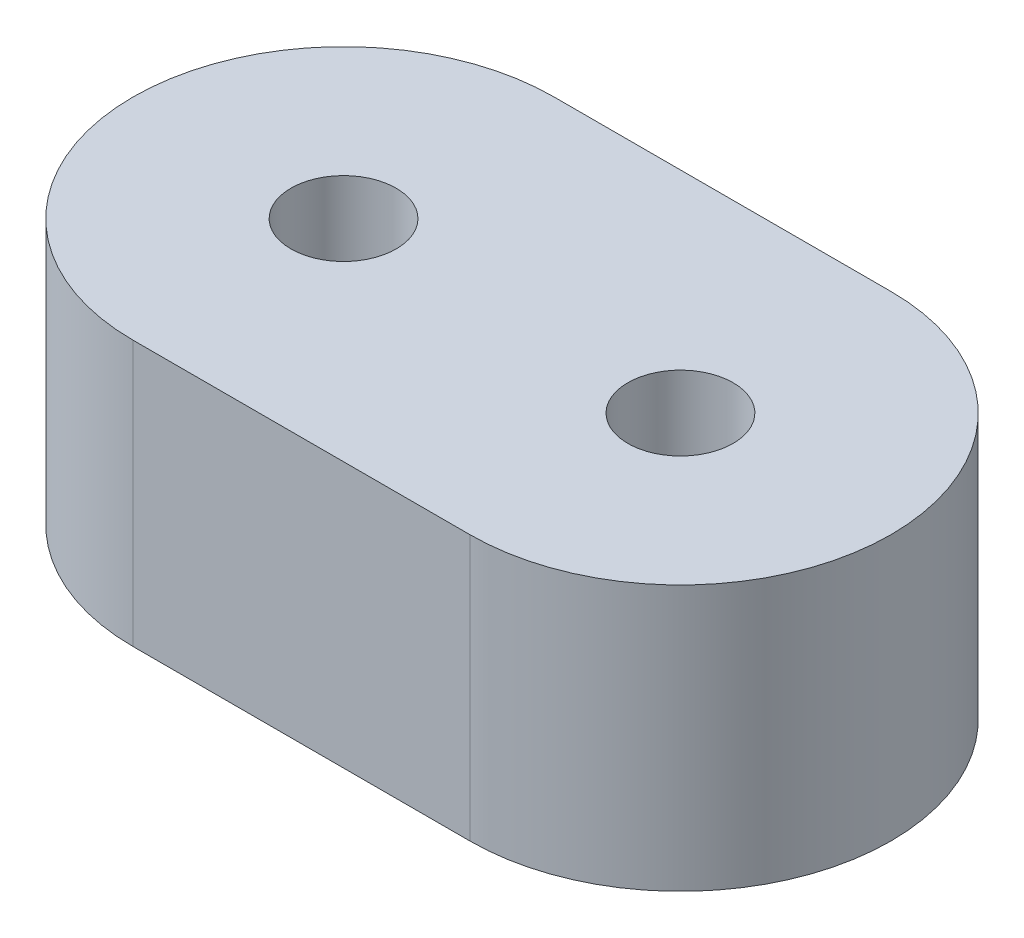
from build123d import *

# Parameters (mm, degrees)
SKETCH1_R           = 1.25
BOSS_EXTRUDE1_DEPTH = 6.3


with BuildPart() as part:
    # Sketch1 → Boss-Extrude1 (new body)
    with BuildSketch(Plane(origin=(0, 0, 0), x_dir=(1, 0, 0), z_dir=(0, 1, 0))):
        with BuildLine():
            Line((0, 5), (8, 5))
            ThreePointArc((8, 5), (13, 0), (8, -5))
            Line((8, -5), (0, -5))
            ThreePointArc((0, -5), (-5, 0), (0, 5))
        make_face()
        with Locations(Location((0, 0, 0), (0, 0, 270))):
            Circle(SKETCH1_R, mode=Mode.SUBTRACT)
        with Locations(Location((8, 0, 0), (0, 0, 90))):
            Circle(SKETCH1_R, mode=Mode.SUBTRACT)
    extrude(amount=BOSS_EXTRUDE1_DEPTH)


solid = part.part
